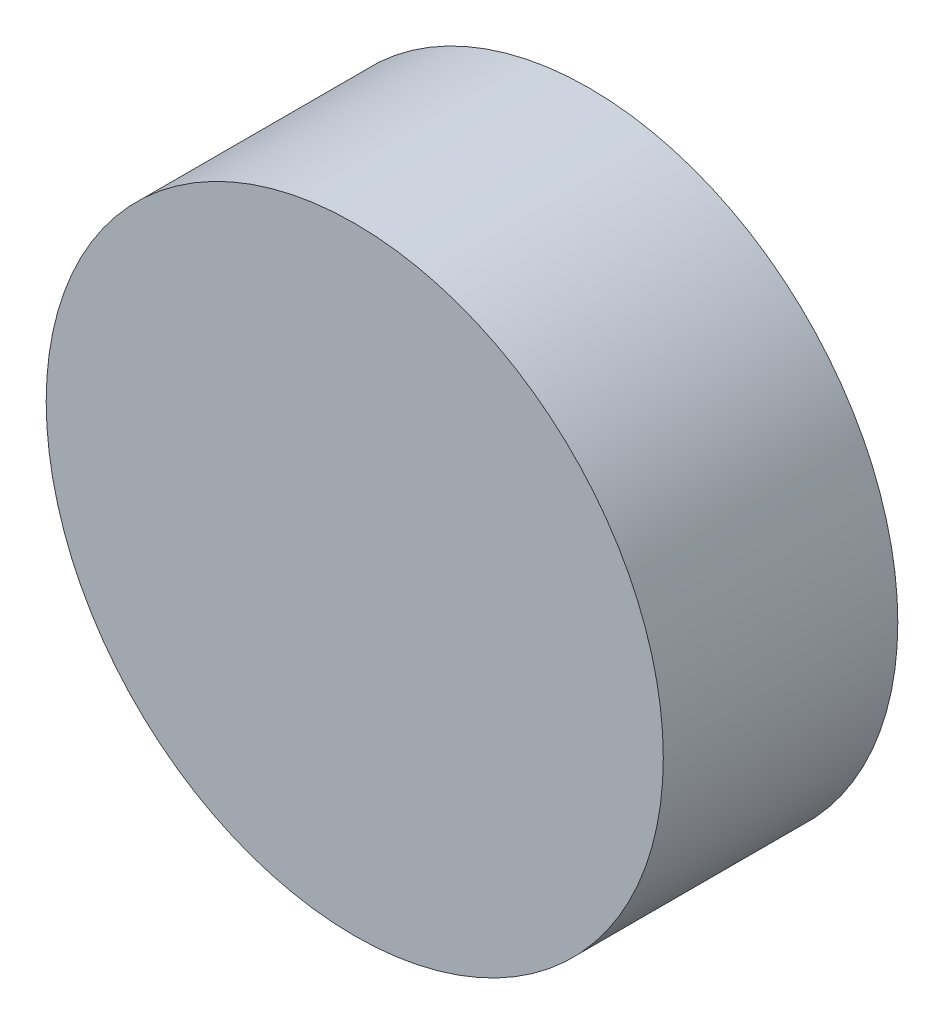
from build123d import *

# Parameters (mm, degrees)
SKETCH_1_R      = 25
SKETCH_1_R_2    = 12.5
EXTRUDE_2_DEPTH = 15
SKETCH_4_R      = 25
EXTRUDE_3_DEPTH = 4


with BuildPart() as part:
    # Эскиз1 → Вытянуть2 (new body)
    with BuildSketch(Plane.XY):
        Circle(SKETCH_1_R)
        Circle(SKETCH_1_R_2, mode=Mode.SUBTRACT)
    extrude(amount=EXTRUDE_2_DEPTH)

    # Эскиз4 → Вытянуть3 (add)
    with BuildSketch(Plane.XY.offset(15)):
        Circle(SKETCH_4_R)
    extrude(amount=EXTRUDE_3_DEPTH)


solid = part.part
